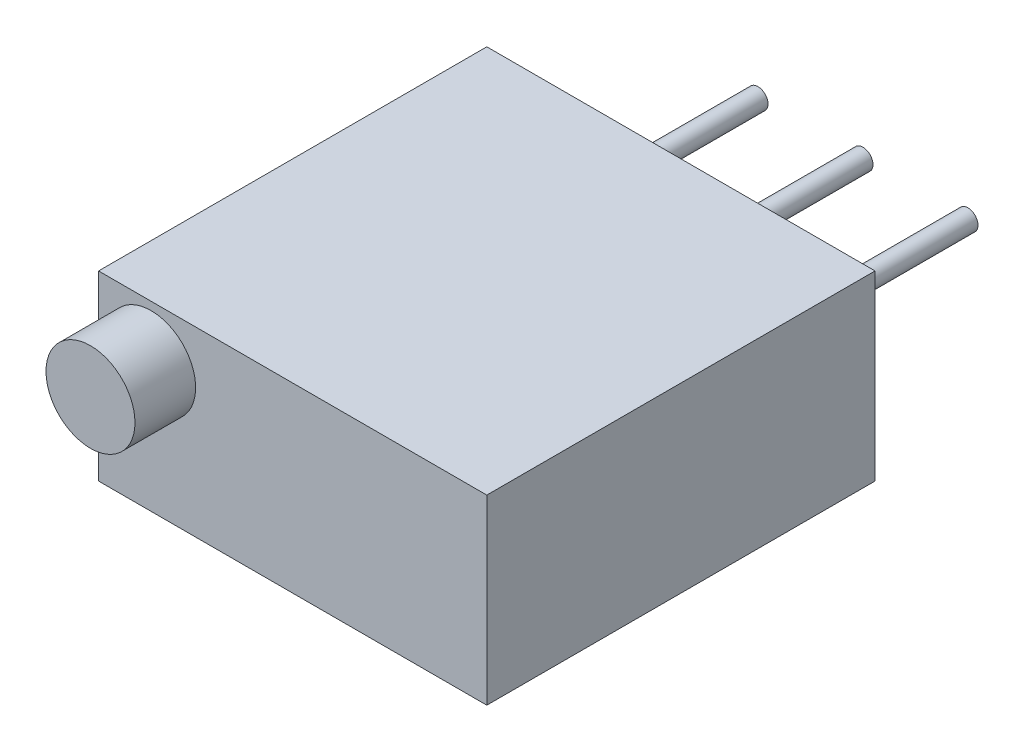
from build123d import *

# Parameters (mm, degrees)
SKETCH_1_W        = 9.6
SKETCH_1_H        = 9.6
EXTRUDE_1_DEPTH   = 4.5
SKETCH_3_R        = 0.25
EXTRUDE_3_DEPTH   = 4.5
SKETCH_4_R        = 1.1
EXTRUDE_1_2_DEPTH = 1.5


with BuildPart() as part:
    # 草图1 → Extrude 1 (new body)
    with BuildSketch(Plane(origin=(0, 0, 0), x_dir=(1, 0, 0), z_dir=(0, 1, 0))):
        Rectangle(SKETCH_1_W, SKETCH_1_H)
    extrude(amount=EXTRUDE_1_DEPTH)

    # 草图3 → 拉伸3 (add)
    with BuildSketch(Plane(origin=(0, 0, -4.8), x_dir=(-1, 0, 0), z_dir=(0, 0, -1))):
        with Locations(Location((0, 2.25, 0), (0, 0, 180))):
            Circle(SKETCH_3_R)
        with Locations(Location((2.595978382, 2.25, 0), (0, 0, 180))):
            Circle(SKETCH_3_R)
        with Locations(Location((-2.595978382, 2.25, 0), (0, 0, 180))):
            Circle(SKETCH_3_R)
    extrude(amount=EXTRUDE_3_DEPTH)

    # 草图4 → Extrude 1 2 (add)
    with BuildSketch(Plane.XY.offset(4.8)):
        with Locations(Location((-3.5, 3.2, 0), (0, 0, 180))):
            Circle(SKETCH_4_R)
    extrude(amount=EXTRUDE_1_2_DEPTH)


solid = part.part
